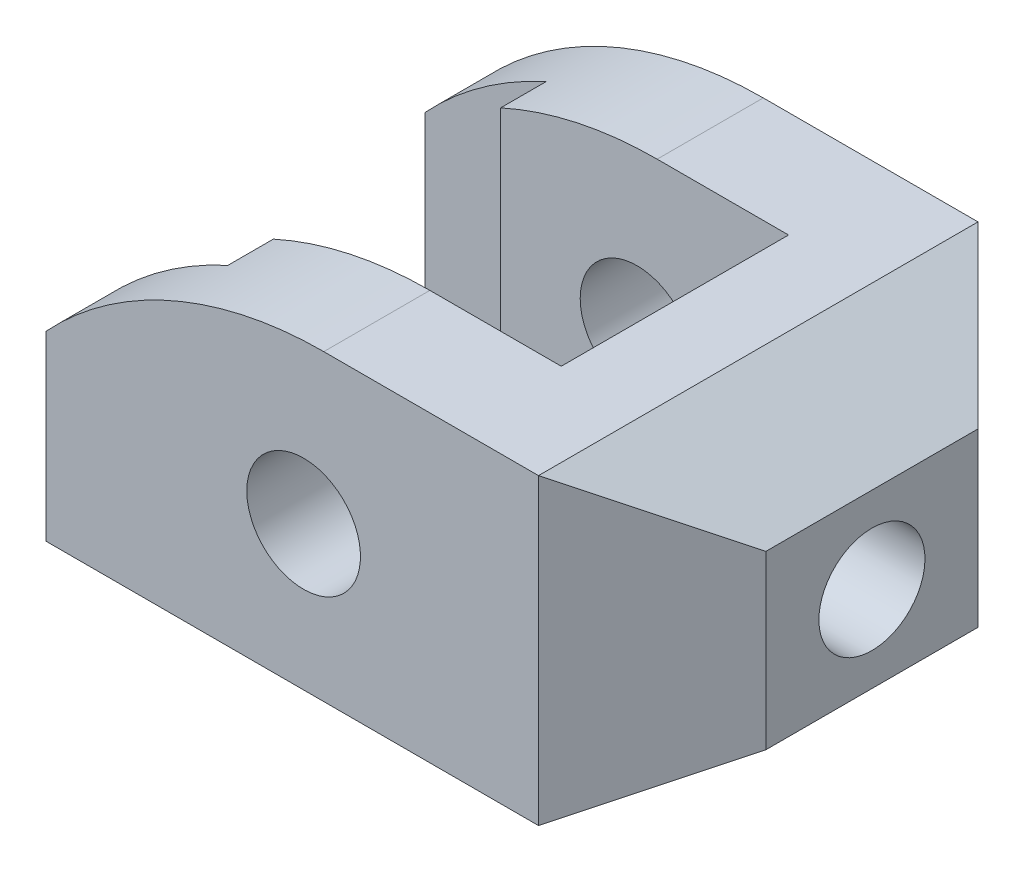
from build123d import *

# Parameters (mm, degrees)
SKETCH1_R               = 7.5
BOSS_EXTRUDE1_DEPTH     = 58
CUT_EXTRUDE1_DEPTH      = 58
CUT_EXTRUDE2_DEPTH      = 58
CUT_EXTRUDE2_DEPTH_BACK = 58
SKETCH5_R               = 7
CUT_EXTRUDE3_DEPTH      = 58


with BuildPart() as part:
    # Sketch1 → Boss-Extrude1 (new body)
    with BuildSketch(Plane.XY):
        with BuildLine():
            Line((-34, 5), (-34, -19))
            Line((-34, -19), (31, -19))
            Line((31, -19), (46, -10.339745962))
            Line((46, -10.339745962), (46, 12.339745962))
            Line((46, 12.339745962), (31, 21))
            Line((31, 21), (2.66060556, 21))
            ThreePointArc((2.66060556, 21), (-17.33939444, 16.82575695), (-34, 5))
        make_face()
        with Locations(Location((0, 0, 0), (0, 0, 180))):
            Circle(SKETCH1_R, mode=Mode.SUBTRACT)
    extrude(amount=BOSS_EXTRUDE1_DEPTH)

    # Sketch3 → Cut-Extrude1 (cut)
    with BuildSketch(Plane.XZ.offset(19)):
        Polygon((-34, 50), (-34, 29), (20, 29), (20, 44), (-18, 44), (-18, 50), align=None)
        Polygon((20, 29), (-34, 29), (-34, 8), (-18, 8), (-18, 14), (20, 14), align=None)
    extrude(amount=-CUT_EXTRUDE1_DEPTH, mode=Mode.SUBTRACT)

    # Sketch4 → Cut-Extrude2 (cut, two sides: drawn at the far end of the back side and taken through both)
    with BuildSketch(Plane(origin=(0, 0, 0), x_dir=(1, 0, 0), z_dir=(0, 1, 0)).offset(-CUT_EXTRUDE2_DEPTH_BACK)):
        Polygon((31, -58), (46, -58), (46, -43), align=None)
        Polygon((46, 0), (46, -15), (31, 0), align=None)
    extrude(amount=CUT_EXTRUDE2_DEPTH + CUT_EXTRUDE2_DEPTH_BACK, mode=Mode.SUBTRACT)

    # Sketch5 → Cut-Extrude3 (cut)
    with BuildSketch(Plane(origin=(46, 0, 0), x_dir=(0, 0, -1), z_dir=(1, 0, 0))):
        with Locations(Location((-29, 1, 0), (0, 0, 90))):
            Circle(SKETCH5_R)
    extrude(amount=-CUT_EXTRUDE3_DEPTH, mode=Mode.SUBTRACT)


solid = part.part
